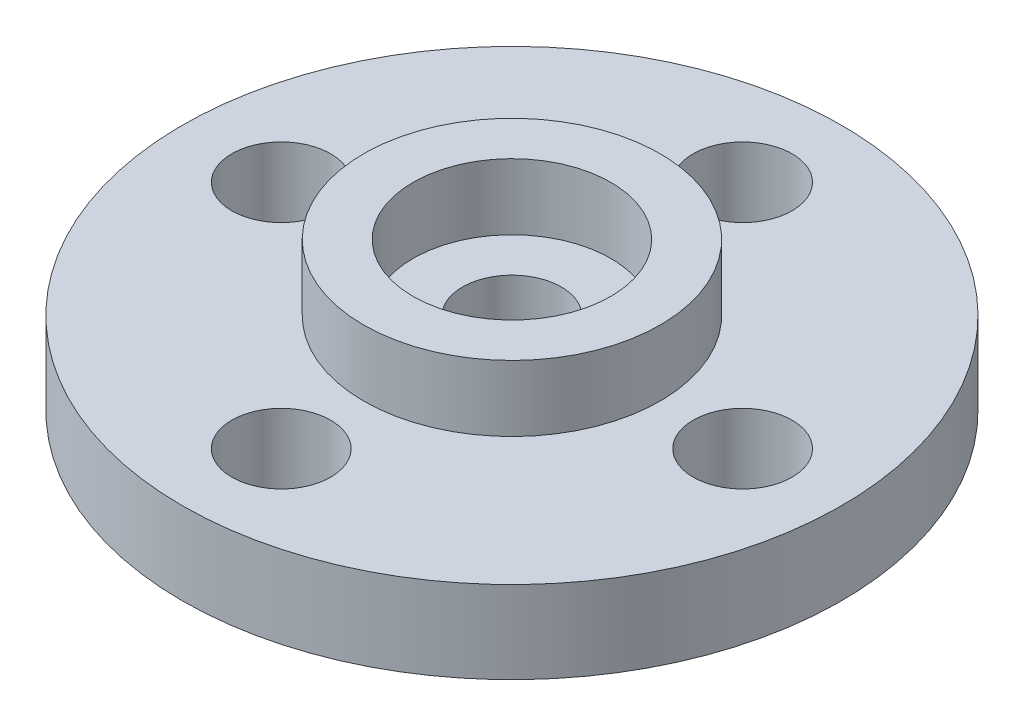
from build123d import *

# Parameters (mm, degrees)
SKETCH_1_R          = 10
EXTRUDE_1_DEPTH     = 2.5
SKETCH_2_R          = 1.5
CUT_EXTRUDE_1_DEPTH = 15.361406616
SKETCH_3_R          = 4.5
EXTRUDE_2_DEPTH     = 2
SKETCH_4_R          = 3
CUT_EXTRUDE_2_DEPTH = 2
SKETCH_5_R          = 1.5
CUT_EXTRUDE_3_DEPTH = 15.361406616


with BuildPart() as part:
    # 草图1 → 凸台-拉伸1 (new body)
    with BuildSketch(Plane(origin=(0, 0, 0), x_dir=(1, 0, 0), z_dir=(0, 1, 0))):
        with Locations(Location((0, 0, 0), (0, 0, 270))):
            Circle(SKETCH_1_R)
    extrude(amount=EXTRUDE_1_DEPTH)

    # 草图2 → 切除-拉伸1 (cut, through all)
    with BuildSketch(Plane(origin=(0, 2.5, 0), x_dir=(1, 0, 0), z_dir=(0, 1, 0))):
        with Locations(Location((0, 7, 0), (0, 0, 270))):
            Circle(SKETCH_2_R)
        with Locations(Location((7, 0, 0), (0, 0, 270))):
            Circle(SKETCH_2_R)
        with Locations(Location((0, -7, 0), (0, 0, 270))):
            Circle(SKETCH_2_R)
        with Locations(Location((-7, 0, 0), (0, 0, 270))):
            Circle(SKETCH_2_R)
    extrude(amount=-CUT_EXTRUDE_1_DEPTH, mode=Mode.SUBTRACT)

    # 草图3 → 凸台-拉伸2 (add)
    with BuildSketch(Plane(origin=(0, 2.5, 0), x_dir=(1, 0, 0), z_dir=(0, 1, 0))):
        with Locations(Location((0, 0, 0), (0, 0, 270))):
            Circle(SKETCH_3_R)
    extrude(amount=EXTRUDE_2_DEPTH)

    # 草图4 → 切除-拉伸2 (cut)
    with BuildSketch(Plane(origin=(0, 4.5, 0), x_dir=(1, 0, 0), z_dir=(0, 1, 0))):
        with Locations(Location((0, 0, 0), (0, 0, 270))):
            Circle(SKETCH_4_R)
    extrude(amount=-CUT_EXTRUDE_2_DEPTH, mode=Mode.SUBTRACT)

    # 草图5 → 切除-拉伸3 (cut, through all)
    with BuildSketch(Plane(origin=(0, 2.5, 0), x_dir=(1, 0, 0), z_dir=(0, 1, 0))):
        with Locations(Location((0, 0, 0), (0, 0, 270))):
            Circle(SKETCH_5_R)
    extrude(amount=-CUT_EXTRUDE_3_DEPTH, mode=Mode.SUBTRACT)


solid = part.part
